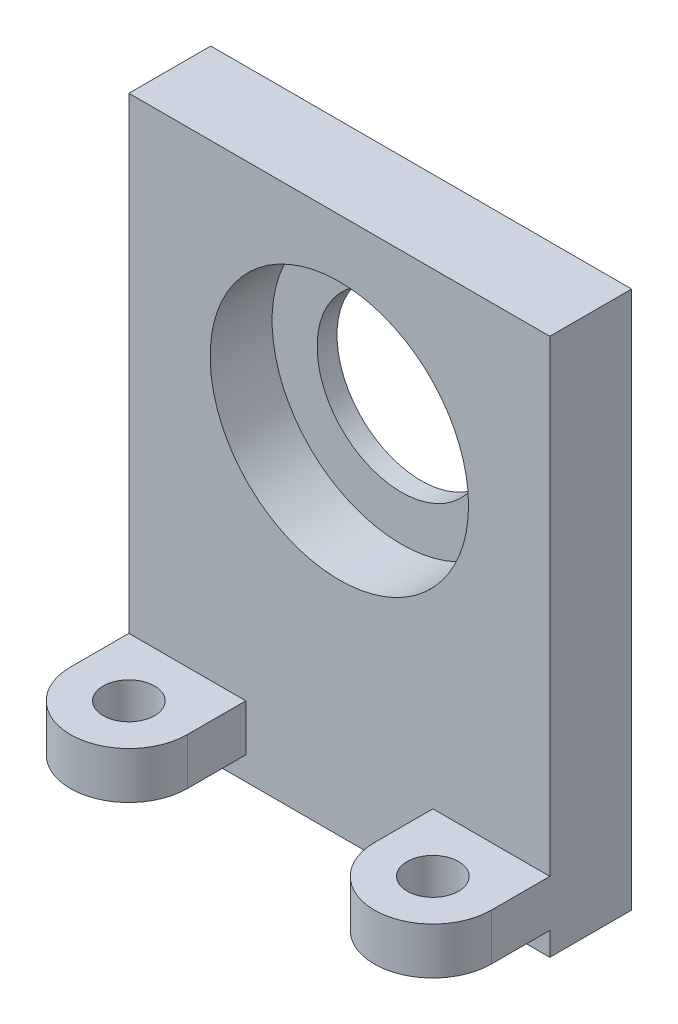
from build123d import *

# Parameters (mm, degrees)
SKETCH_1_W          = 18
SKETCH_1_H          = 22
EXTRUDE_1_DEPTH     = 3.5
SKETCH_2_R          = 3.6
CUT_EXTRUDE_1_DEPTH = 3.5
SKETCH_3_R          = 5.525
CUT_EXTRUDE_2_DEPTH = 2.65
SKETCH_4_W          = 5
SKETCH_4_H          = 5
EXTRUDE_2_DEPTH     = 2
FILLET_1_RADIUS     = 2.5
FILLET_1_LENGTH     = 2
SKETCH_5_R          = 1.1
CUT_EXTRUDE_3_DEPTH = 3
SKETCH_6_W          = 18
SKETCH_6_H          = 3.5
EXTRUDE_3_DEPTH     = 1


with BuildPart() as part:
    # 草图1 → 凸台-拉伸1 (new body)
    with BuildSketch(Plane.XY):
        Rectangle(SKETCH_1_W, SKETCH_1_H)
    extrude(amount=EXTRUDE_1_DEPTH)

    # 草图2 → 切除-拉伸1 (cut)
    with BuildSketch(Plane.XY.offset(3.5)):
        with Locations((0, 3)):
            Circle(SKETCH_2_R)
    extrude(amount=-CUT_EXTRUDE_1_DEPTH, mode=Mode.SUBTRACT)

    # 草图3 → 切除-拉伸2 (cut)
    with BuildSketch(Plane.XY.offset(3.5)):
        with Locations((0, 3)):
            Circle(SKETCH_3_R)
    extrude(amount=-CUT_EXTRUDE_2_DEPTH, mode=Mode.SUBTRACT)

    # 草图4 → 凸台-拉伸2 (add)
    with BuildSketch(Plane.XZ.offset(11)):
        with Locations((-6.5, 6)):
            Rectangle(SKETCH_4_W, SKETCH_4_H)
    extrude(amount=-EXTRUDE_2_DEPTH)

    # 圆角1: full round fillet: the end face becomes a half cylinder, R = half its width
    fillet_1_face = Plane((-6.5, -10, 8.5), x_dir=(0, -1, 0), z_dir=(0, 0, 1))  # on the end face: x along it, z out of the body
    fillet_1_slab = fillet_1_face.offset(-FILLET_1_RADIUS / 2) * Box(FILLET_1_LENGTH, 2 * FILLET_1_RADIUS, FILLET_1_RADIUS, mode=Mode.PRIVATE)  # the body's end, R deep
    fillet_1_round = Plane((-6.5, -10, 6), x_dir=(0, 0, 1), z_dir=(0, -1, 0)) * Cylinder(FILLET_1_RADIUS, FILLET_1_LENGTH, mode=Mode.PRIVATE)  # its axis R under the face
    add(fillet_1_slab - fillet_1_round, mode=Mode.SUBTRACT)

    # 草图5 → 切除-拉伸3 (cut)
    with BuildSketch(Plane(origin=(0, -9, 0), x_dir=(1, 0, 0), z_dir=(0, 1, 0))):
        with Locations(Location((-6.5, -6, 0), (0, 0, 270))):
            Circle(SKETCH_5_R)
    extrude(amount=-CUT_EXTRUDE_3_DEPTH, mode=Mode.SUBTRACT)

    # 镜向6: part across plane


with BuildPart() as part_1:
    add(part.part)
    add(part.part.mirror(Plane.ZY))

    # 草图6 → 凸台-拉伸3 (add)
    with BuildSketch(Plane.XZ.offset(11)):
        with Locations((0, 1.75)):
            Rectangle(SKETCH_6_W, SKETCH_6_H)
    extrude(amount=EXTRUDE_3_DEPTH)


solid = part_1.part
